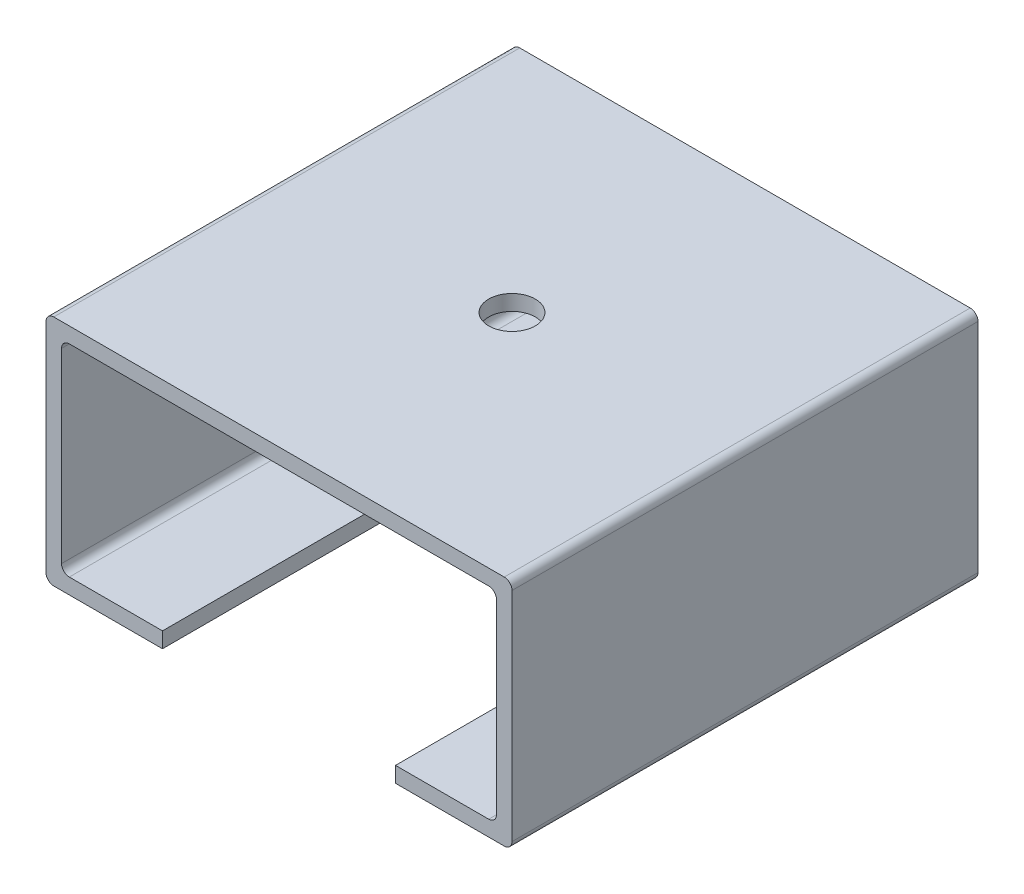
from build123d import *

# Parameters (mm, degrees)
BOSS_EXTRUDE1_DEPTH = 60
FILLET1_R           = 1
SKETCH2_R           = 3
CUT_EXTRUDE1_DEPTH  = 2


with BuildPart() as part:
    # Sketch1 → Boss-Extrude1 (new body)
    with BuildSketch(Plane.XY):
        Polygon((-15, 0), (-15, 2), (-28, 2), (-28, 28), (28, 28), (28, 2), (15, 2), (15, 0), (30, 0), (30, 30), (-30, 30), (-30, 0), align=None)
    extrude(amount=BOSS_EXTRUDE1_DEPTH)

    # Fillet1
    fillet1_edges = [part.edges().sort_by_distance(p)[0] for p in [
        (28, 2, 30),
        (28, 28, 30),
        (-28, 28, 30),
        (-28, 2, 30),
        (-30, 0, 30),
        (-30, 30, 30),
        (30, 30, 30),
        (30, 0, 30),
    ]]
    fillet(fillet1_edges, radius=FILLET1_R)

    # Sketch2 → Cut-Extrude1 (cut)
    with BuildSketch(Plane(origin=(0, 30, 0), x_dir=(1, 0, 0), z_dir=(0, 1, 0))):
        with Locations(Location((0, -30, 0), (0, 0, 180))):
            Circle(SKETCH2_R)
    extrude(amount=-CUT_EXTRUDE1_DEPTH, mode=Mode.SUBTRACT)


solid = part.part
